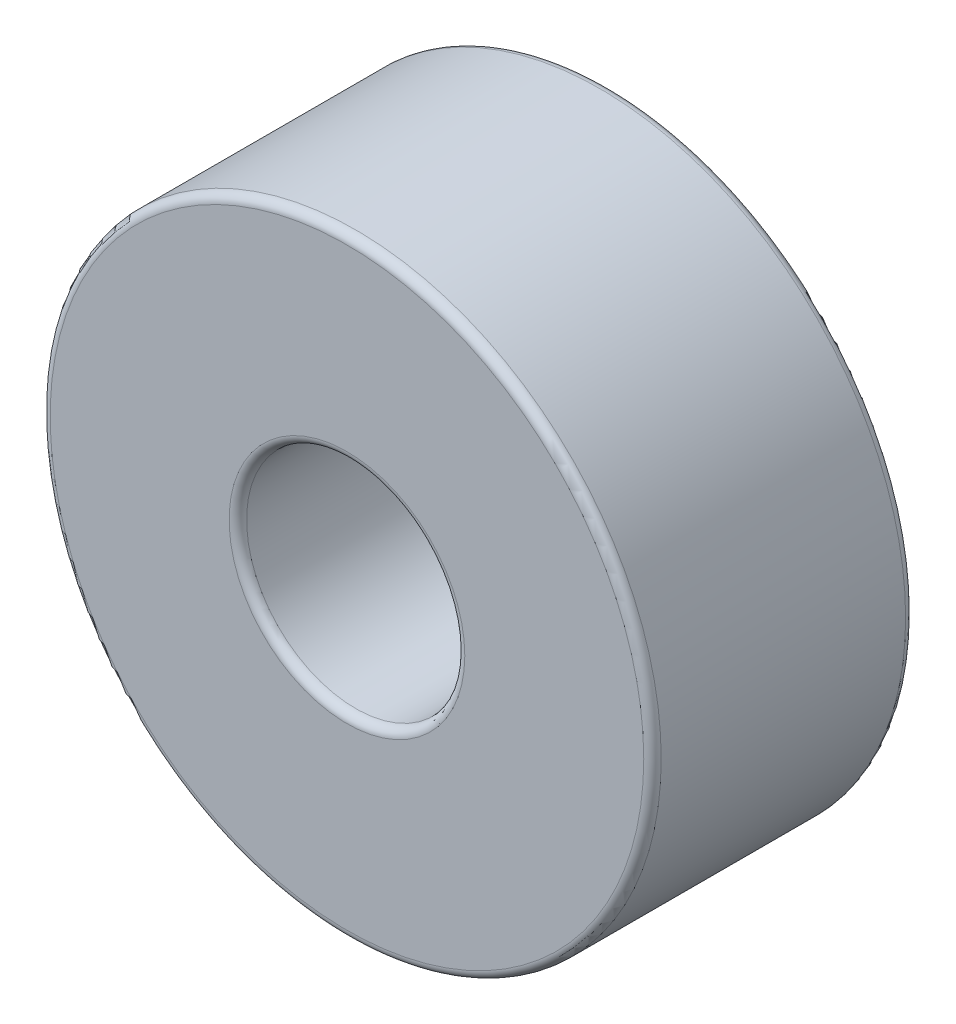
from build123d import *

# Parameters (mm, degrees)
SKETCH_1_R          = 7
EXTRUDE_1_DEPTH     = 6
SKETCH_2_R          = 2.5
CUT_EXTRUDE_1_DEPTH = 12.575836903
FILLET_1_R          = 0.2


with BuildPart() as part:
    # 草图1 → 凸台-拉伸1 (new body)
    with BuildSketch(Plane.XY):
        Circle(SKETCH_1_R)
    extrude(amount=EXTRUDE_1_DEPTH)

    # 草图2 → 切除-拉伸1 (cut, through all)
    with BuildSketch(Plane.XY.offset(6)):
        Circle(SKETCH_2_R)
    extrude(amount=-CUT_EXTRUDE_1_DEPTH, mode=Mode.SUBTRACT)

    # 圆角1
    fillet_1_edges = [part.edges().sort_by_distance(p)[0] for p in [
        (-7, 0, 0),
        (-7, 0, 6),
        (-2.5, 0, 0),
        (-2.5, 0, 6),
    ]]
    fillet(fillet_1_edges, radius=FILLET_1_R)


solid = part.part
